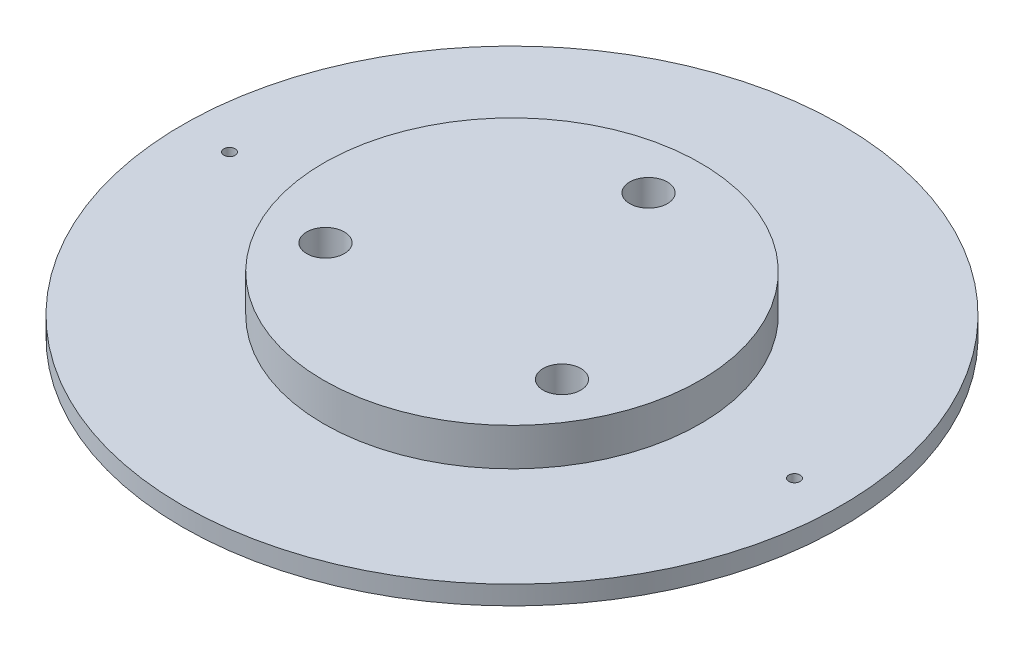
from build123d import *

# Parameters (mm, degrees)
SKETCH_1_R      = 100
SKETCH_1_R_2    = 10
EXTRUDE_1_DEPTH = 20
SKETCH_2_R      = 175
SKETCH_2_R_2    = 3
EXTRUDE_2_DEPTH = 10


with BuildPart() as part:
    # 草圖1 → 填料-伸長1 (new body)
    with BuildSketch(Plane(origin=(0, 0, 0), x_dir=(1, 0, 0), z_dir=(0, 1, 0))):
        with Locations(Location((0, 0, 0), (0, 0, 270))):
            Circle(SKETCH_1_R)
        with Locations(Location((0, 72.5, 0), (0, 0, 270))):
            Circle(SKETCH_1_R_2, mode=Mode.SUBTRACT)
        with Locations(Location((62.786841774, -36.25, 0), (0, 0, 270))):
            Circle(SKETCH_1_R_2, mode=Mode.SUBTRACT)
        with Locations(Location((-62.786841774, -36.25, 0), (0, 0, 270))):
            Circle(SKETCH_1_R_2, mode=Mode.SUBTRACT)
    extrude(amount=EXTRUDE_1_DEPTH)

    # 草圖2 → 填料-伸長2 (add)
    with BuildSketch(Plane.XZ):
        with Locations(Location((0, 0, 0), (0, 0, 270))):
            Circle(SKETCH_2_R)
        with Locations(Location((-150, 0, 0), (0, 0, 270))):
            Circle(SKETCH_2_R_2, mode=Mode.SUBTRACT)
        with Locations(Location((150, 0, 0), (0, 0, 270))):
            Circle(SKETCH_2_R_2, mode=Mode.SUBTRACT)
    extrude(amount=EXTRUDE_2_DEPTH)


solid = part.part
